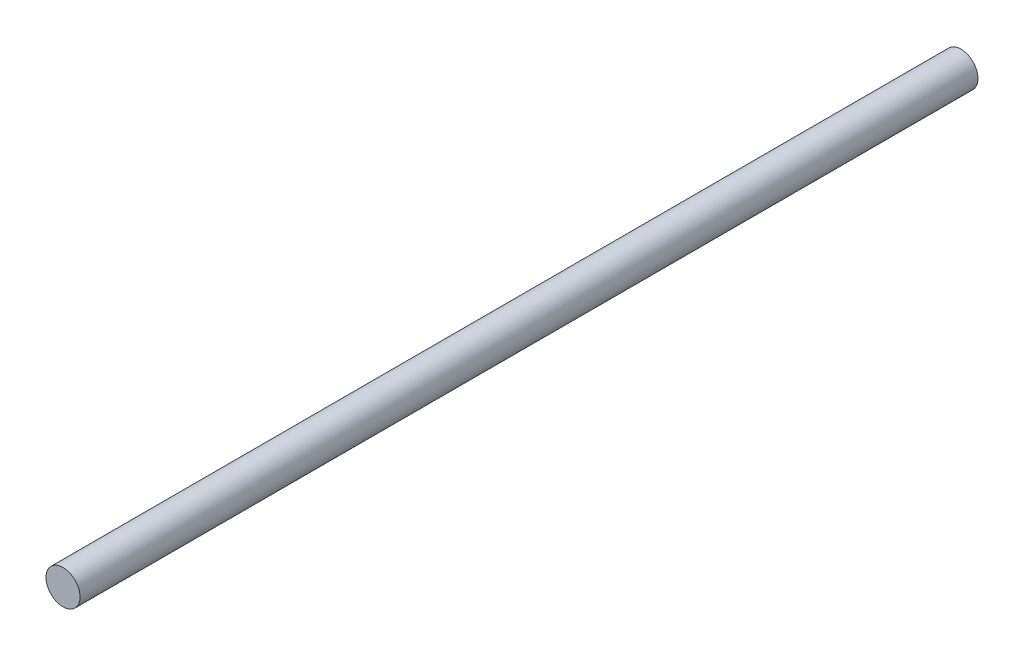
from build123d import *

# Parameters (mm, degrees)
AUFSATZ_LINEAR_AUSTRAGEN1_DEPTH      = 30
AUFSATZ_LINEAR_AUSTRAGEN1_DEPTH_BACK = 49
SKIZZE1_R                            = 1.5


with BuildPart() as part:
    # Skizze1 → Aufsatz-Linear austragen1 (new, two sides: drawn at the far end of the back side and taken through both)
    with BuildSketch(Plane.XY.offset(-AUFSATZ_LINEAR_AUSTRAGEN1_DEPTH_BACK)):
        Circle(SKIZZE1_R)
    extrude(amount=AUFSATZ_LINEAR_AUSTRAGEN1_DEPTH + AUFSATZ_LINEAR_AUSTRAGEN1_DEPTH_BACK)


solid = part.part
